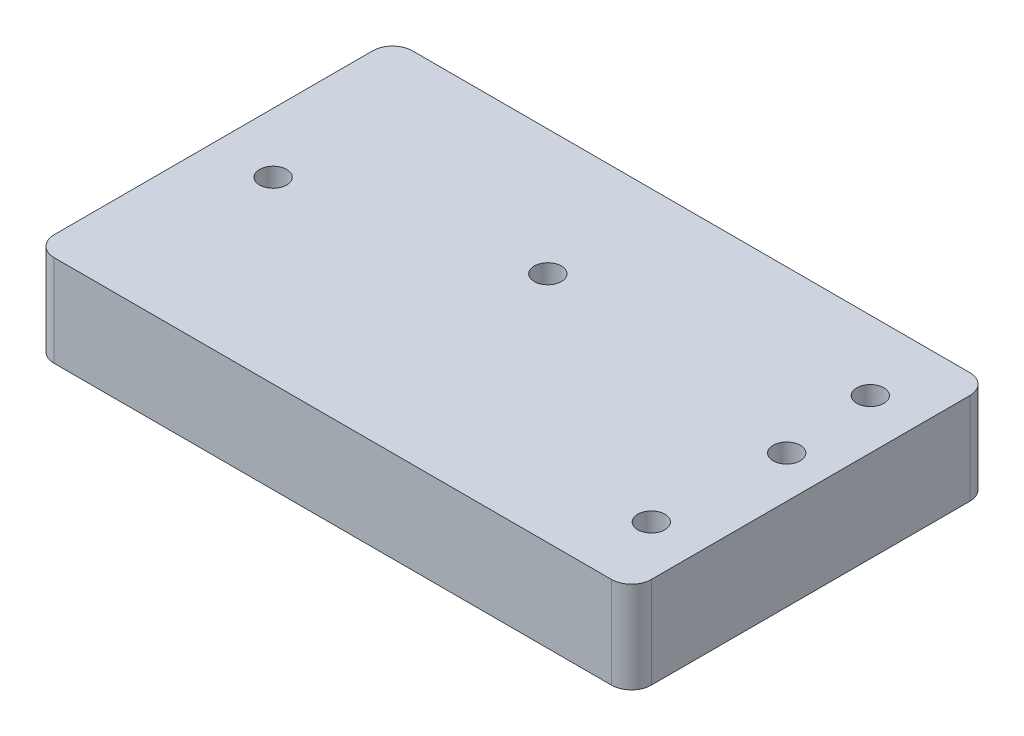
from build123d import *

# Parameters (mm, degrees)
SKETCH2_W                 = 76.2
SKETCH2_H                 = 45.72
BOSS_EXTRUDE3_DEPTH       = 11.684
SKETCH6_R                 = 1.7272
CUT_EXTRUDE2_DEPTH        = 90.628534831
SKETCH7_R                 = 1.7272
CUT_EXTRUDE3_DEPTH        = 90.628534831
SKETCH8_R                 = 1.7272
CUT_EXTRUDE4_DEPTH        = 90.628534831
SKETCH9_R                 = 1.397
CUT_EXTRUDE5_DEPTH        = 15.24
F_4_40_TAPPED_HOLE1_D     = 2.2606
F_4_40_TAPPED_HOLE1_DEPTH = 7.62
F_4_40_TAPPED_HOLE1_TIP   = 0.679152758
F_8_32_TAPPED_HOLE1_D     = 3.4544
F_8_32_TAPPED_HOLE1_DEPTH = 12.446
F_8_32_TAPPED_HOLE1_TIP   = 1.037806461
F_8_32_TAPPED_HOLE2_D     = 3.4544
F_8_32_TAPPED_HOLE2_DEPTH = 12.446
F_8_32_TAPPED_HOLE2_TIP   = 1.037806461
FILLET1_R                 = 2.54


with BuildPart() as part:
    # Sketch2 → Boss-Extrude3 (new body)
    with BuildSketch(Plane(origin=(0, 0, 0), x_dir=(1, 0, 0), z_dir=(0, 1, 0))):
        with Locations((38.1, -22.86)):
            Rectangle(SKETCH2_W, SKETCH2_H)
    extrude(amount=BOSS_EXTRUDE3_DEPTH)

    # Sketch6 → Cut-Extrude2 (cut, through all)
    with BuildSketch(Plane(origin=(0, 11.684, 0), x_dir=(1, 0, 0), z_dir=(0, 1, 0))):
        with Locations(Location((7.62, -22.86, 0), (0, 0, 270))):
            Circle(SKETCH6_R)
    extrude(amount=-CUT_EXTRUDE2_DEPTH, mode=Mode.SUBTRACT)

    # Sketch7 → Cut-Extrude3 (cut, through all)
    with BuildSketch(Plane(origin=(0, 11.684, 0), x_dir=(1, 0, 0), z_dir=(0, 1, 0))):
        with Locations(Location((69.85, -8.89, 0), (0, 0, 270))):
            Circle(SKETCH7_R)
    extrude(amount=-CUT_EXTRUDE3_DEPTH, mode=Mode.SUBTRACT)

    # Sketch8 → Cut-Extrude4 (cut, through all)
    with BuildSketch(Plane(origin=(0, 11.684, 0), x_dir=(1, 0, 0), z_dir=(0, 1, 0))):
        with Locations(Location((69.85, -36.83, 0), (0, 0, 270))):
            Circle(SKETCH8_R)
    extrude(amount=-CUT_EXTRUDE4_DEPTH, mode=Mode.SUBTRACT)

    # Sketch9 → Cut-Extrude5 (cut)
    with BuildSketch(Plane.ZY):
        with Locations((27.94, 9.017)):
            Circle(SKETCH9_R)
    extrude(amount=-CUT_EXTRUDE5_DEPTH, mode=Mode.SUBTRACT)

    # #4-40 Tapped Hole1
    with Locations(Plane(origin=(0, 0, 0), x_dir=(-1, 0, 0), z_dir=(0, -1, 0))):
        with Locations((-3.175, -3.5052), (-3.175, -37.1602), (-14.605, -3.5052), (-14.605, -37.1602)):
            Hole(F_4_40_TAPPED_HOLE1_D / 2, depth=F_4_40_TAPPED_HOLE1_DEPTH)
            with Locations((0, 0, -(F_4_40_TAPPED_HOLE1_DEPTH + F_4_40_TAPPED_HOLE1_TIP / 2))):  # 118° drill point
                Cone(0, F_4_40_TAPPED_HOLE1_D / 2, F_4_40_TAPPED_HOLE1_TIP, mode=Mode.SUBTRACT)

    # #8-32 Tapped Hole1
    with Locations(Plane(origin=(70.866, 0, 20.574), x_dir=(0, 0, -1), z_dir=(0, -1, 0))):
        with Locations((0, 0)):
            Hole(F_8_32_TAPPED_HOLE1_D / 2, depth=F_8_32_TAPPED_HOLE1_DEPTH)
            with Locations((0, 0, -(F_8_32_TAPPED_HOLE1_DEPTH + F_8_32_TAPPED_HOLE1_TIP / 2))):  # 118° drill point
                Cone(0, F_8_32_TAPPED_HOLE1_D / 2, F_8_32_TAPPED_HOLE1_TIP, mode=Mode.SUBTRACT)

    # #8-32 Tapped Hole2
    with Locations(Plane(origin=(35.814, 0, 16.002), x_dir=(0, 0, -1), z_dir=(0, -1, 0))):
        with Locations((0, 0)):
            Hole(F_8_32_TAPPED_HOLE2_D / 2, depth=F_8_32_TAPPED_HOLE2_DEPTH)
            with Locations((0, 0, -(F_8_32_TAPPED_HOLE2_DEPTH + F_8_32_TAPPED_HOLE2_TIP / 2))):  # 118° drill point
                Cone(0, F_8_32_TAPPED_HOLE2_D / 2, F_8_32_TAPPED_HOLE2_TIP, mode=Mode.SUBTRACT)

    # Fillet1
    fillet1_edges = [part.edges().sort_by_distance(p)[0] for p in [
        (0, 5.842, 0),
        (76.2, 5.842, 0),
        (76.2, 5.842, 45.72),
        (0, 5.842, 45.72),
    ]]
    fillet(fillet1_edges, radius=FILLET1_R)


solid = part.part
